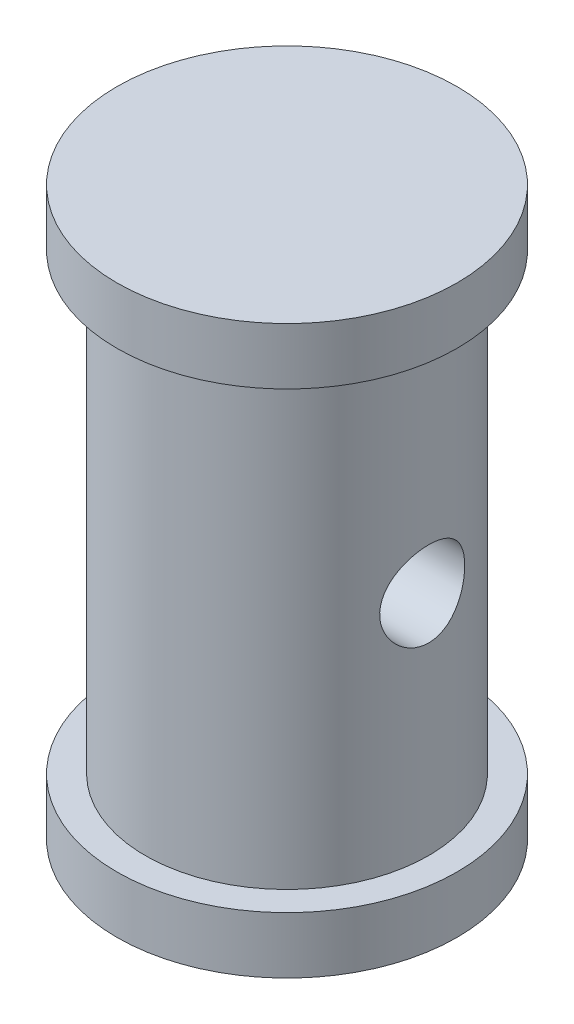
from build123d import *

# Parameters (mm, degrees)
CROQUIS3_R            = 2.49
CORTAR_EXTRUIR1_DEPTH = 18
CROQUIS4_R            = 1.5
CORTAR_EXTRUIR2_DEPTH = 3


with BuildPart() as part:
    # Croquis2 → Revolución1 (revolve)
    with BuildSketch(Plane.XY, mode=Mode.PRIVATE) as revoluci_n1_sk:
        Polygon((0, 0), (-6, 0), (-6, 2), (-5, 2), (-5, 18), (-6, 18), (-6, 20), (0, 20), align=None)
    revolve(revoluci_n1_sk.sketch.rotate(Axis((0, 0, 0), (0, 1, 0)), 270), axis=Axis((0, 0, 0), (0, 1, 0)))

    # Croquis3 → Cortar-Extruir1 (cut)
    with BuildSketch(Plane.XZ):
        with Locations(Location((0, 0, 0), (0, 0, 270))):
            Circle(CROQUIS3_R)
    extrude(amount=-CORTAR_EXTRUIR1_DEPTH, mode=Mode.SUBTRACT)

    # Croquis4 → Cortar-Extruir2 (cut)
    with BuildSketch(Plane(origin=(5, 0, 0), x_dir=(0, 0, -1), z_dir=(1, 0, 0))):
        with Locations((0, 10)):
            Circle(CROQUIS4_R)
    extrude(amount=-CORTAR_EXTRUIR2_DEPTH, mode=Mode.SUBTRACT)


solid = part.part
